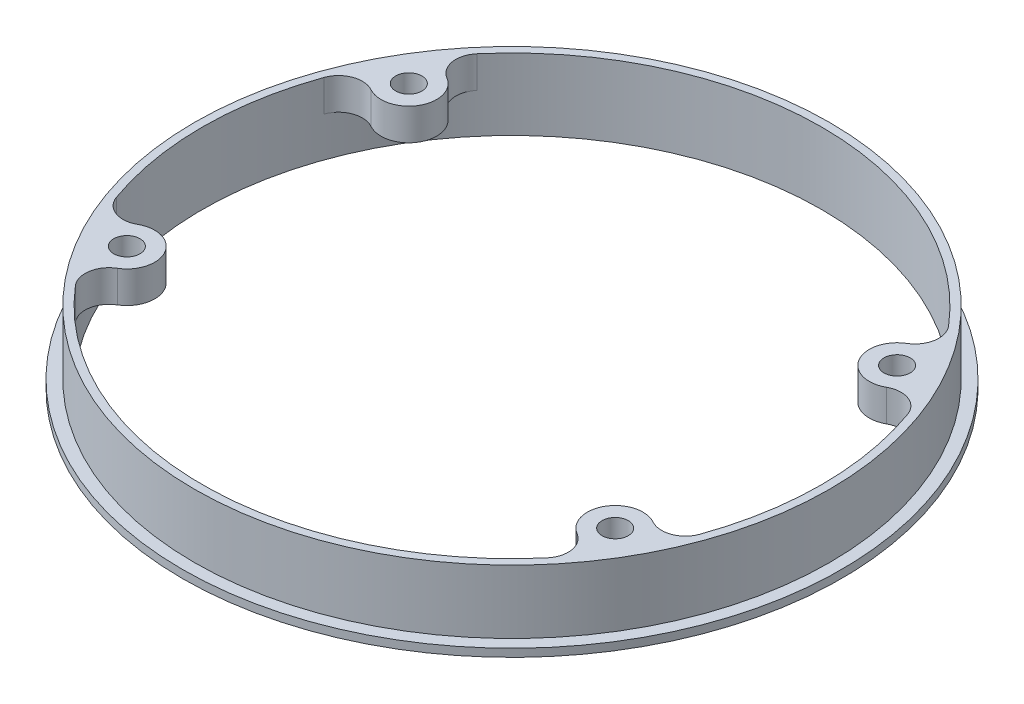
from build123d import *

# Parameters (mm, degrees)
HOLE_WIZARD_M4_1_D  = 3.3
CUT_EXTRUDE_1_DEPTH = 60.375921


with BuildPart() as part:
    # 草图1 → 旋转1 (revolve)
    with BuildSketch(Plane.XY, mode=Mode.PRIVATE) as revolve_1_sk:
        Polygon((-41.5, 0), (-39, 0), (-39, 5), (-32, 5), (-32, 9), (-40, 9), (-40, 1), (-41.5, 1), align=None)
    revolve(revolve_1_sk.sketch.rotate(Axis((0, 0, 0), (0, 1, 0)), 270), axis=Axis((0, 0, 0), (0, 1, 0)))

    # M4 螺纹孔1 (through all)
    with Locations(Plane(origin=(0, 9, 0), x_dir=(-1, 0, 0), z_dir=(0, 1, 0))):
        with Locations((0, -35.5), (30.743902, -17.75), (30.743902, 17.75), (0, 35.5), (-30.743902, 17.75), (-30.743902, -17.75)):
            Hole(HOLE_WIZARD_M4_1_D / 2)

    # 草图4 → 切除-拉伸1 (cut, through all)
    with BuildSketch(Plane(origin=(0, 9, 0), x_dir=(1, 0, 0), z_dir=(0, 1, 0))):
        with BuildLine():
            ThreePointArc((-32.451037, 14.694564), (-27.712813, 16), (-28.951384, 20.75614))
            ThreePointArc((-28.951384, 20.75614), (-30.374691, 22.843063), (-29.699519, 25.277235))
            ThreePointArc((-29.699519, 25.277235), (-19.5, 33.774991), (-7.040968, 38.359155))
            ThreePointArc((-7.040968, 38.359155), (0, 39), (7.040968, 38.359155))
            ThreePointArc((7.040968, 38.359155), (19.5, 33.774991), (29.699519, 25.277235))
            ThreePointArc((29.699519, 25.277235), (30.374691, 22.843063), (28.951384, 20.75614))
            ThreePointArc((28.951384, 20.75614), (27.712813, 16), (32.451037, 14.694564))
            ThreePointArc((32.451037, 14.694564), (34.970019, 14.883723), (36.740487, 13.08192))
            ThreePointArc((36.740487, 13.08192), (39, 0), (36.740487, -13.08192))
            ThreePointArc((36.740487, -13.08192), (34.970019, -14.883723), (32.451037, -14.694564))
            ThreePointArc((32.451037, -14.694564), (27.712813, -16), (28.951384, -20.75614))
            ThreePointArc((28.951384, -20.75614), (30.374691, -22.843063), (29.699519, -25.277235))
            ThreePointArc((29.699519, -25.277235), (19.5, -33.774991), (7.040968, -38.359155))
            ThreePointArc((7.040968, -38.359155), (0, -39), (-7.040968, -38.359155))
            ThreePointArc((-7.040968, -38.359155), (-19.5, -33.774991), (-29.699519, -25.277235))
            ThreePointArc((-29.699519, -25.277235), (-30.374691, -22.843063), (-28.951384, -20.75614))
            ThreePointArc((-28.951384, -20.75614), (-27.712813, -16), (-32.451037, -14.694564))
            ThreePointArc((-32.451037, -14.694564), (-34.970019, -14.883723), (-36.740487, -13.08192))
            ThreePointArc((-36.740487, -13.08192), (-39, 0), (-36.740487, 13.08192))
            ThreePointArc((-36.740487, 13.08192), (-34.970019, 14.883723), (-32.451037, 14.694564))
        make_face()
    extrude(amount=-CUT_EXTRUDE_1_DEPTH, mode=Mode.SUBTRACT)


solid = part.part
